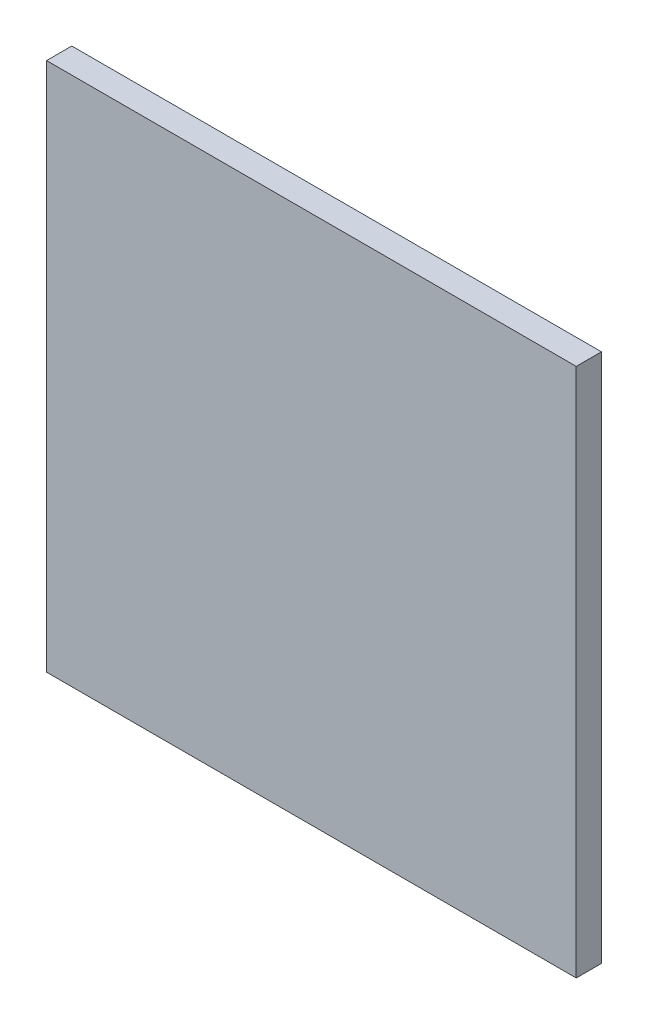
from build123d import *

# Parameters (mm, degrees)
SKETCH1_W           = 105
SKETCH1_H           = 105
BOSS_EXTRUDE1_DEPTH = 5


with BuildPart() as part:
    # Sketch1 → Boss-Extrude1 (new body)
    with BuildSketch(Plane.XY):
        with Locations((0, 52.5)):
            Rectangle(SKETCH1_W, SKETCH1_H)
    extrude(amount=BOSS_EXTRUDE1_DEPTH)


solid = part.part
